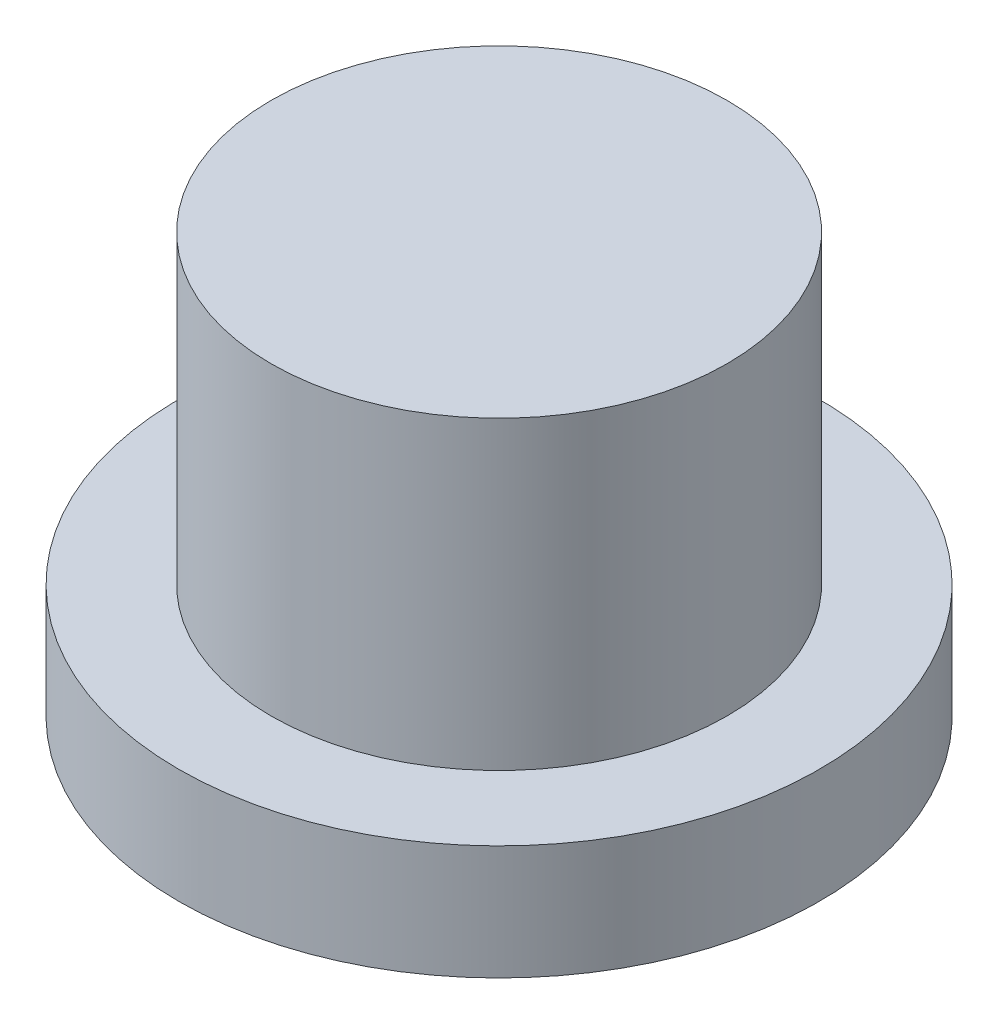
from build123d import *

# Parameters (mm, degrees)
CROQUIS1_R                 = 21
SALIENTE_EXTRUIR1_DEPTH    = 7.5
CROQUIS2_R                 = 14.95
SALIENTE_EXTRUIR2_DEPTH    = 20
CORTAR_EXTRUIR1_DEPTH      = 41.475301111
CORTAR_EXTRUIR1_DEPTH_BACK = 2.5
CORTAR_EXTRUIR2_DEPTH      = 39.820097888
CORTAR_EXTRUIR2_DEPTH_BACK = 1.5
CROQUIS4_R                 = 5.5


with BuildPart() as part:
    # Croquis1 → Saliente-Extruir1 (new body)
    with BuildSketch(Plane(origin=(0, 0, 0), x_dir=(1, 0, 0), z_dir=(0, 1, 0))):
        with Locations(Location((0, 0, 0), (0, 0, 270))):
            Circle(CROQUIS1_R)
    extrude(amount=SALIENTE_EXTRUIR1_DEPTH)

    # Croquis2 → Saliente-Extruir2 (add)
    with BuildSketch(Plane(origin=(0, 7.5, 0), x_dir=(1, 0, 0), z_dir=(0, 1, 0))):
        with Locations(Location((0, 0, 0), (0, 0, 270))):
            Circle(CROQUIS2_R)
    extrude(amount=SALIENTE_EXTRUIR2_DEPTH)

    # Croquis3 → Cortar-Extruir1 (cut, two sides: drawn at the far end of the back side and taken through both)
    with BuildSketch(Plane.XZ.offset(-CORTAR_EXTRUIR1_DEPTH_BACK)):
        with BuildLine():
            Line((-4.971667622, -4.813784484), (-7.886808716, -5.156697725))
            Line((-7.886808716, -5.156697725), (-17.496587444, -4.741948795))
            ThreePointArc((-17.496587444, -4.741948795), (-20.06167777, -2.359890899), (-18.11936882, 0.552380405))
            Line((-18.11936882, 0.552380405), (-8.868149486, 3.18578214))
            Line((-8.868149486, 3.18578214), (-5.953008392, 3.528695381))
            ThreePointArc((-5.953008392, 3.528695381), (-5.084547102, 4.014240505), (-4.813784484, 4.971667622))
            Line((-4.813784484, 4.971667622), (-5.156697725, 7.886808716))
            Line((-5.156697725, 7.886808716), (-4.741948795, 17.496587444))
            ThreePointArc((-4.741948795, 17.496587444), (-2.359890899, 20.06167777), (0.552380405, 18.11936882))
            Line((0.552380405, 18.11936882), (3.18578214, 8.868149486))
            Line((3.18578214, 8.868149486), (3.528695381, 5.953008392))
            ThreePointArc((3.528695381, 5.953008392), (4.014240505, 5.084547102), (4.971667622, 4.813784484))
            Line((4.971667622, 4.813784484), (7.886808716, 5.156697725))
            Line((7.886808716, 5.156697725), (17.496587444, 4.741948795))
            ThreePointArc((17.496587444, 4.741948795), (20.06167777, 2.359890899), (18.11936882, -0.552380405))
            Line((18.11936882, -0.552380405), (8.868149486, -3.18578214))
            Line((8.868149486, -3.18578214), (5.953008392, -3.528695381))
            ThreePointArc((5.953008392, -3.528695381), (5.084547102, -4.014240505), (4.813784484, -4.971667622))
            Line((4.813784484, -4.971667622), (5.156697725, -7.886808716))
            Line((5.156697725, -7.886808716), (4.741948795, -17.496587444))
            ThreePointArc((4.741948795, -17.496587444), (2.359890899, -20.06167777), (-0.552380405, -18.11936882))
            Line((-0.552380405, -18.11936882), (-3.18578214, -8.868149486))
            Line((-3.18578214, -8.868149486), (-3.528695381, -5.953008392))
            ThreePointArc((-3.528695381, -5.953008392), (-4.014240505, -5.084547102), (-4.971667622, -4.813784484))
        make_face()
    extrude(amount=CORTAR_EXTRUIR1_DEPTH + CORTAR_EXTRUIR1_DEPTH_BACK, mode=Mode.SUBTRACT)

    # Croquis4 → Cortar-Extruir2 (cut, two sides: drawn at the far end of the back side and taken through both)
    with BuildSketch(Plane.XZ.offset(-2.5).offset(-CORTAR_EXTRUIR2_DEPTH_BACK)):
        with Locations(Location((0, 0, 0), (0, 0, 270))):
            Circle(CROQUIS4_R)
    extrude(amount=CORTAR_EXTRUIR2_DEPTH + CORTAR_EXTRUIR2_DEPTH_BACK, mode=Mode.SUBTRACT)


solid = part.part
